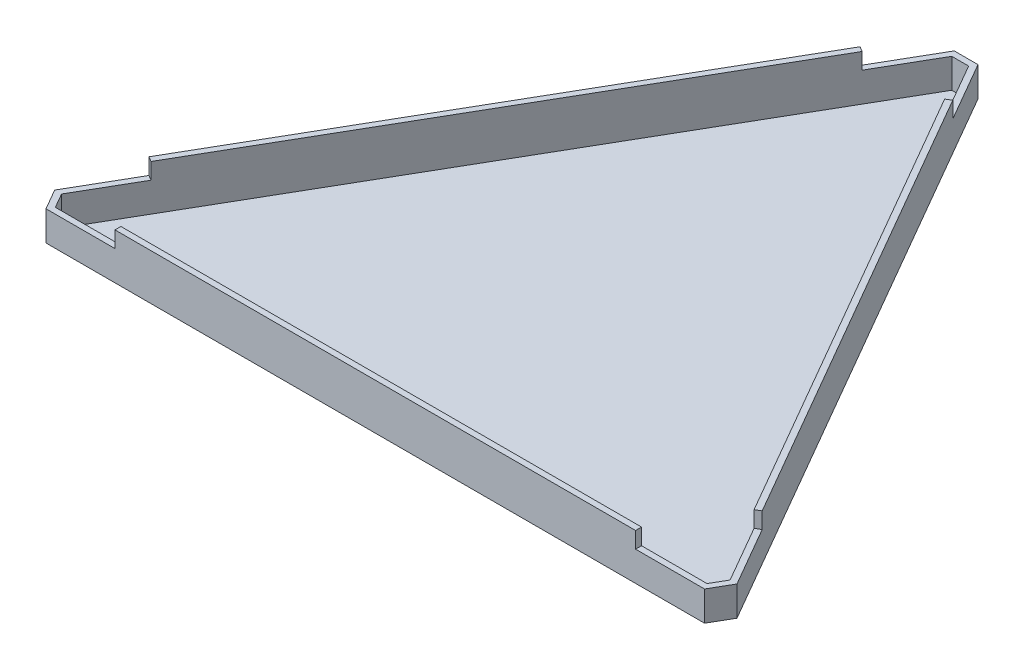
from build123d import *

# Parameters (mm, degrees)
BOSS_EXTRUDE1_DEPTH = 0.08
BOSS_EXTRUDE2_DEPTH = 10
SKETCH1_4_W         = 175.5
SKETCH1_4_H         = 2
BOSS_EXTRUDE3_DEPTH = 15.46


with BuildPart() as part:
    # Sketch1 → Boss-Extrude1 (new body)
    with BuildSketch(Plane(origin=(0, 0, 0), x_dir=(1, 0, 0), z_dir=(0, 1, 0))):
        Polygon((-115, 0), (-111, -6.92820323), (111, -6.92820323), (115, 0), (4, 192.25763964), (-4, 192.25763964), align=None)
    extrude(amount=BOSS_EXTRUDE1_DEPTH)

    # Sketch1<3> → Boss-Extrude2 (add)
    with BuildSketch(Plane(origin=(0, 0, 0), x_dir=(1, 0, 0), z_dir=(0, 1, 0))):
        Polygon((-103.375, 20.135090638), (-115, 0), (-111, -6.92820323), (-87.75, -6.92820323), (-87.75, -4.92820323), (-109.845299462, -4.92820323), (-112.690598923, 0), (-101.642949192, 19.135090638), align=None)
        Polygon((-4, 192.25763964), (-15.625, 172.122549002), (-13.892949192, 171.122549002), (-2.845299462, 190.25763964), (2.845299462, 190.25763964), (13.892949192, 171.122549002), (15.625, 172.122549002), (4, 192.25763964), align=None)
        Polygon((87.75, -4.92820323), (87.75, -6.92820323), (111, -6.92820323), (115, 0), (103.375, 20.135090638), (101.642949192, 19.135090638), (112.690598923, 0), (109.845299462, -4.92820323), align=None)
    extrude(amount=BOSS_EXTRUDE2_DEPTH)

    # Sketch1<4> → Boss-Extrude3 (add)
    with BuildSketch(Plane(origin=(0, 0, 0), x_dir=(1, 0, 0), z_dir=(0, 1, 0))):
        Polygon((-15.625, 172.122549002), (-103.375, 20.135090638), (-101.642949192, 19.135090638), (-13.892949192, 171.122549002), align=None)
        with Locations((0, -5.92820323)):
            Rectangle(SKETCH1_4_W, SKETCH1_4_H)
        Polygon((103.375, 20.135090638), (15.625, 172.122549002), (13.892949192, 171.122549002), (101.642949192, 19.135090638), align=None)
    extrude(amount=BOSS_EXTRUDE3_DEPTH)


solid = part.part
